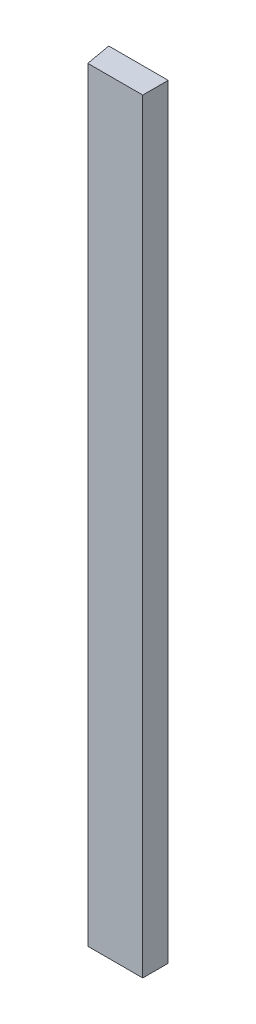
from build123d import *

# Parameters (mm, degrees)
BOSS_EXTRUDE1_DEPTH = 1143


with BuildPart() as part:
    # Sketch1 → Boss-Extrude1 (new body)
    with BuildSketch(Plane(origin=(0, 0, 0), x_dir=(1, 0, 0), z_dir=(0, 1, 0))):
        Polygon((-44.45, 19.05), (-37.731942035, -19.05), (44.45, -19.05), (44.45, 19.05), align=None)
    extrude(amount=BOSS_EXTRUDE1_DEPTH)


solid = part.part
